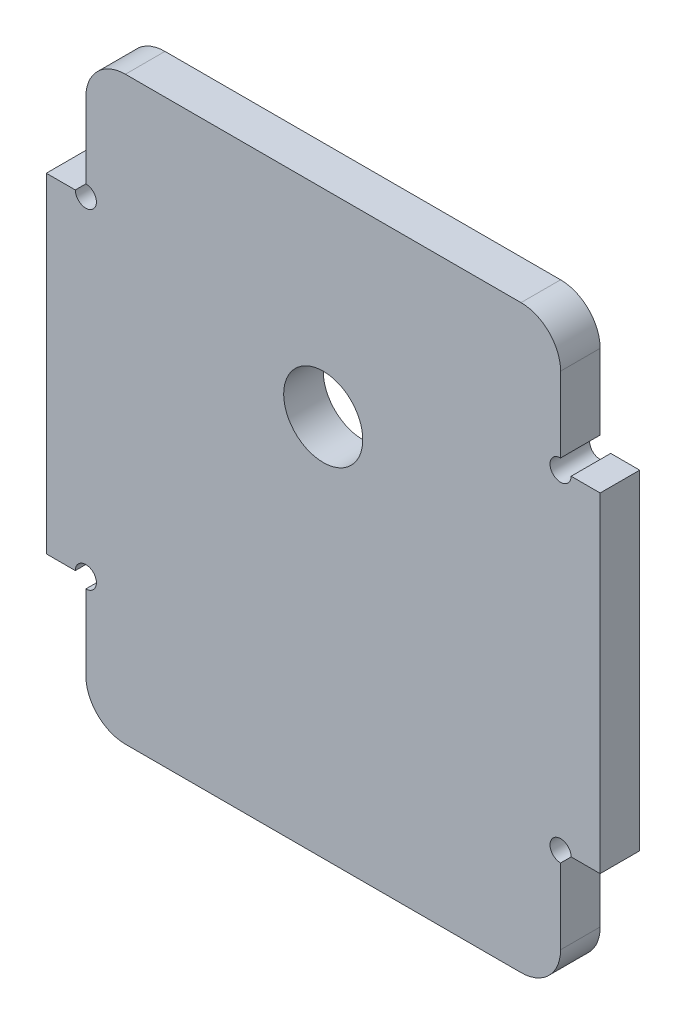
from build123d import *

# Parameters (mm, degrees)
SKETCH1_W           = 3
SKETCH1_H           = 25
BOSS_EXTRUDE1_DEPTH = 3
SKETCH5_R           = 3
CUT_EXTRUDE3_DEPTH  = 31.56141358
SKETCH6_R           = 0.8
CUT_EXTRUDE4_DEPTH  = 31.56141358
FILLET1_R           = 3


with BuildPart() as part:
    # Sketch1 → Boss-Extrude1 (new body)
    with BuildSketch(Plane.XY):
        Polygon((-18, -12.5), (-18, -22), (18, -22), (18, -12.5), (15, -12.5), (15, 12.5), (18, 12.5), (18, 22), (-18, 22), (-18, 12.5), (-15, 12.5), (-15, -12.5), align=None)
        with Locations((-19.5, 0)):
            Rectangle(SKETCH1_W, SKETCH1_H)
        with Locations((-16.5, 0)):
            Rectangle(SKETCH1_W, SKETCH1_H)
        with Locations((19.5, 0)):
            Rectangle(SKETCH1_W, SKETCH1_H)
        with Locations((16.5, 0)):
            Rectangle(SKETCH1_W, SKETCH1_H)
    extrude(amount=BOSS_EXTRUDE1_DEPTH)

    # Sketch5 → Cut-Extrude3 (cut, through all)
    with BuildSketch(Plane(origin=(0, 0, 0), x_dir=(-1, 0, 0), z_dir=(0, 0, -1))):
        with Locations((0, 7)):
            Circle(SKETCH5_R)
    extrude(amount=-CUT_EXTRUDE3_DEPTH, mode=Mode.SUBTRACT)

    # Sketch6 → Cut-Extrude4 (cut, through all)
    with BuildSketch(Plane(origin=(0, 0, 0), x_dir=(-1, 0, 0), z_dir=(0, 0, -1))):
        with Locations((-18, 12.5)):
            Circle(SKETCH6_R)
        with Locations((-18, -12.5)):
            Circle(SKETCH6_R)
        with Locations((18, -12.5)):
            Circle(SKETCH6_R)
        with Locations((18, 12.5)):
            Circle(SKETCH6_R)
    extrude(amount=-CUT_EXTRUDE4_DEPTH, mode=Mode.SUBTRACT)

    # Fillet1
    fillet1_edges = [part.edges().sort_by_distance(p)[0] for p in [
        (-18, 22, 1.5),
        (18, 22, 1.5),
        (18, -22, 1.5),
        (-18, -22, 1.5),
    ]]
    fillet(fillet1_edges, radius=FILLET1_R)


solid = part.part
